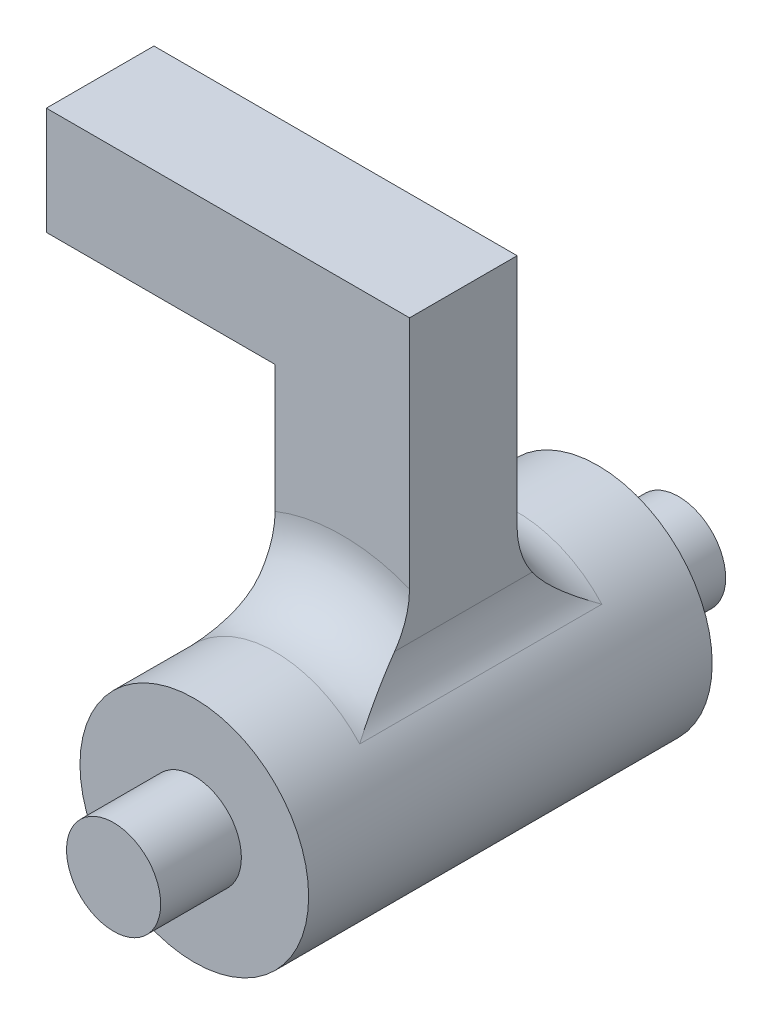
from build123d import *

# Parameters (mm, degrees)
BOSS_EXTRUDE1_DEPTH      = 15
BOSS_EXTRUDE1_DEPTH_BACK = 15
SKETCH1_R                = 8.5
BOSS_EXTRUDE2_DEPTH      = 4
BOSS_EXTRUDE2_DEPTH_BACK = 4
FILLET1_R                = 5
SKETCH3_W                = 8
SKETCH3_H                = 8
BOSS_EXTRUDE3_DEPTH      = 17
BOSS_EXTRUDE4_DEPTH      = 6
BOSS_EXTRUDE4_DEPTH_BACK = 36
SKETCH4_R                = 3.5


with BuildPart() as part:
    # Sketch1 → Boss-Extrude1 (new, two sides: drawn at the far end of the back side and taken through both)
    with BuildSketch(Plane.XY.offset(-BOSS_EXTRUDE1_DEPTH_BACK)):
        Circle(SKETCH1_R)
    extrude(amount=BOSS_EXTRUDE1_DEPTH + BOSS_EXTRUDE1_DEPTH_BACK)

    # Sketch2 → Boss-Extrude2 (add, two sides: drawn at the far end of the back side and taken through both)
    with BuildSketch(Plane.XY.offset(-BOSS_EXTRUDE2_DEPTH_BACK)):
        with BuildLine():
            Line((-5, 6.873863542), (-5, 30))
            Line((-5, 30), (5, 30))
            Line((5, 30), (5, 6.873863542))
            ThreePointArc((5, 6.873863542), (0, 8.5), (-5, 6.873863542))
        make_face()
    extrude(amount=BOSS_EXTRUDE2_DEPTH + BOSS_EXTRUDE2_DEPTH_BACK)

    # Fillet1
    fillet1_edges = [part.edges().sort_by_distance(p)[0] for p in [
        (0, 8.5, -4),
        (-5, 6.873863542, 0),
        (0, 8.5, 4),
        (5, 6.873863542, 0),
    ]]
    fillet(fillet1_edges, radius=FILLET1_R)

    # Sketch3 → Boss-Extrude3 (add)
    with BuildSketch(Plane.ZY.offset(5)):
        with Locations((0, 26)):
            Rectangle(SKETCH3_W, SKETCH3_H)
    extrude(amount=BOSS_EXTRUDE3_DEPTH)

    # Sketch4 → Boss-Extrude4 (add, two sides: drawn at the far end of the back side and taken through both)
    with BuildSketch(Plane.XY.offset(15).offset(-BOSS_EXTRUDE4_DEPTH_BACK)):
        Circle(SKETCH4_R)
    extrude(amount=BOSS_EXTRUDE4_DEPTH + BOSS_EXTRUDE4_DEPTH_BACK)


solid = part.part
